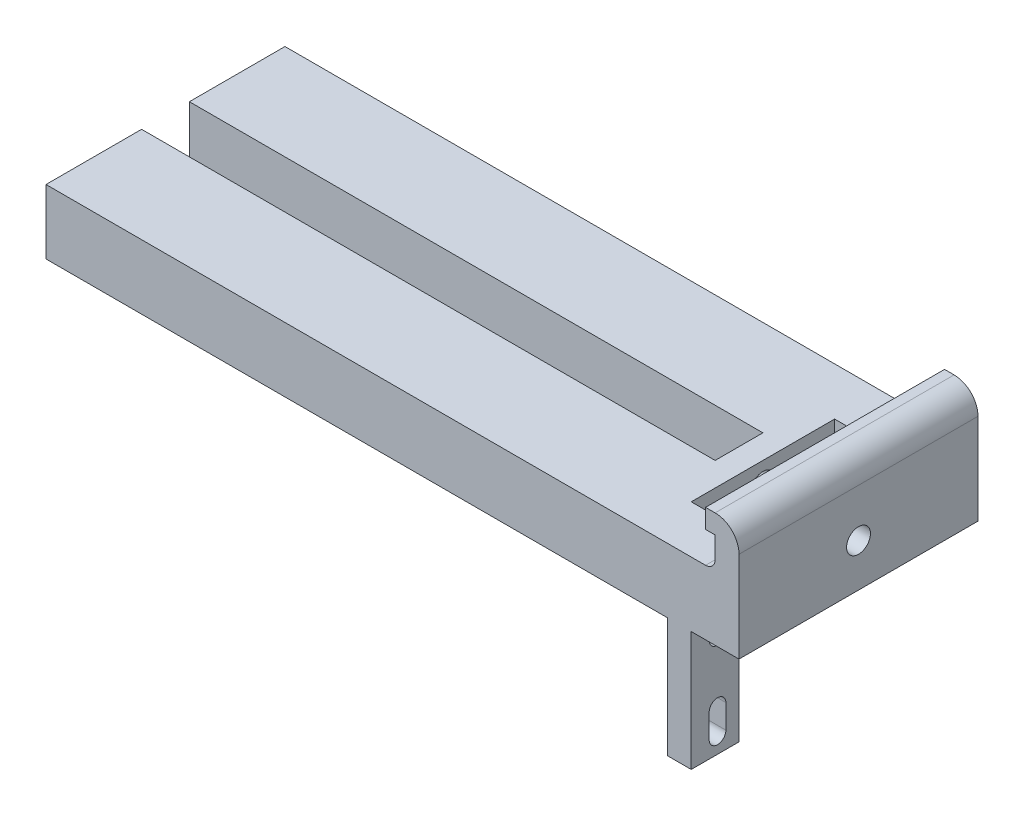
from build123d import *

# Parameters (mm, degrees)
SKETCH1_W               = 140
SKETCH1_H               = 13.5
BOSS_EXTRUDE1_DEPTH     = 50
SKETCH2_R               = 3
CUT_EXTRUDE1_DEPTH      = 5
SKETCH3_W               = 50
SKETCH3_H               = 24
BOSS_EXTRUDE2_DEPTH     = 5
CUT_EXTRUDE2_DEPTH      = 151.585523873
CUT_EXTRUDE2_DEPTH_BACK = 151.585523873
SKETCH4_W               = 10
SKETCH4_H               = 30
SKETCH5_R               = 2.5
CUT_EXTRUDE3_DEPTH      = 35
SKETCH6_W               = 50
SKETCH6_H               = 4
BOSS_EXTRUDE3_DEPTH     = 2
CUT_EXTRUDE4_DEPTH      = 150.272402004
CUT_EXTRUDE4_DEPTH_BACK = 150.272402004
SKETCH7_W               = 120
SKETCH7_H               = 10
SKETCH8_W               = 5
SKETCH8_H               = 10
BOSS_EXTRUDE4_DEPTH     = 25
CUT_EXTRUDE5_DEPTH      = 142.509716981
CUT_EXTRUDE5_DEPTH_BACK = 142.509716981
SKETCH10_R              = 1.75
FILLET1_R               = 2
FILLET2_R               = 5


with BuildPart() as part:
    # Sketch1 → Boss-Extrude1 (new body)
    with BuildSketch(Plane.XY):
        with Locations((-70, 6.75)):
            Rectangle(SKETCH1_W, SKETCH1_H)
    extrude(amount=BOSS_EXTRUDE1_DEPTH)

    # Sketch2 → Cut-Extrude1 (cut)
    with BuildSketch(Plane.ZY.offset(140)):
        with Locations((12.5, 6.75)):
            Circle(SKETCH2_R)
        with Locations((25, 6.75)):
            Circle(SKETCH2_R)
        with Locations((37.5, 6.75)):
            Circle(SKETCH2_R)
    extrude(amount=-CUT_EXTRUDE1_DEPTH, mode=Mode.SUBTRACT)

    # Sketch3 → Boss-Extrude2 (add)
    with BuildSketch(Plane(origin=(0, 0, 0), x_dir=(0, 0, -1), z_dir=(1, 0, 0))):
        with Locations((-25, 12)):
            Rectangle(SKETCH3_W, SKETCH3_H)
    extrude(amount=BOSS_EXTRUDE2_DEPTH)

    # Sketch4 → Cut-Extrude2 (cut, two sides: drawn at the far end of the back side and taken through both)
    with BuildSketch(Plane.XZ.offset(-CUT_EXTRUDE2_DEPTH_BACK)):
        with Locations((-10, 25)):
            Rectangle(SKETCH4_W, SKETCH4_H)
    extrude(amount=CUT_EXTRUDE2_DEPTH + CUT_EXTRUDE2_DEPTH_BACK, mode=Mode.SUBTRACT)

    # Sketch5 → Cut-Extrude3 (cut)
    with BuildSketch(Plane(origin=(5, 0, 0), x_dir=(0, 0, -1), z_dir=(1, 0, 0))):
        with Locations(Location((-25, 9, 0), (0, 0, 90))):
            Circle(SKETCH5_R)
    extrude(amount=-CUT_EXTRUDE3_DEPTH, mode=Mode.SUBTRACT)

    # Sketch6 → Boss-Extrude3 (add)
    with BuildSketch(Plane.ZY):
        with Locations((25, 22)):
            Rectangle(SKETCH6_W, SKETCH6_H)
    extrude(amount=BOSS_EXTRUDE3_DEPTH)

    # Sketch7 → Cut-Extrude4 (cut, two sides: drawn at the far end of the back side and taken through both)
    with BuildSketch(Plane(origin=(0, 13.5, 0), x_dir=(1, 0, 0), z_dir=(0, 1, 0)).offset(-CUT_EXTRUDE4_DEPTH_BACK)):
        with Locations((-80, -25)):
            Rectangle(SKETCH7_W, SKETCH7_H)
    extrude(amount=CUT_EXTRUDE4_DEPTH + CUT_EXTRUDE4_DEPTH_BACK, mode=Mode.SUBTRACT)

    # Sketch8 → Boss-Extrude4 (add)
    with BuildSketch(Plane.XZ):
        with Locations((-7.5, 45)):
            Rectangle(SKETCH8_W, SKETCH8_H)
    extrude(amount=BOSS_EXTRUDE4_DEPTH)

    # Sketch10 → Cut-Extrude5 (cut, two sides: drawn at the far end of the back side and taken through both)
    with BuildSketch(Plane.ZY.offset(10).offset(-CUT_EXTRUDE5_DEPTH_BACK)):
        with Locations((44.5, -3.5)):
            Circle(SKETCH10_R)
        with BuildLine():
            Line((46.25, -16.5), (46.25, -21.5))
            ThreePointArc((46.25, -21.5), (44.5, -23.25), (42.75, -21.5))
            Line((42.75, -21.5), (42.75, -16.5))
            ThreePointArc((42.75, -16.5), (44.5, -14.75), (46.25, -16.5))
        make_face()
    extrude(amount=CUT_EXTRUDE5_DEPTH + CUT_EXTRUDE5_DEPTH_BACK, mode=Mode.SUBTRACT)

    # Fillet1
    fillet1_edges = [part.edges().sort_by_distance(p)[0] for p in [
        (0, 13.5, 25),
    ]]
    fillet(fillet1_edges, radius=FILLET1_R)

    # Fillet2
    fillet2_edges = [part.edges().sort_by_distance(p)[0] for p in [
        (5, 24, 25),
    ]]
    fillet(fillet2_edges, radius=FILLET2_R)


solid = part.part
